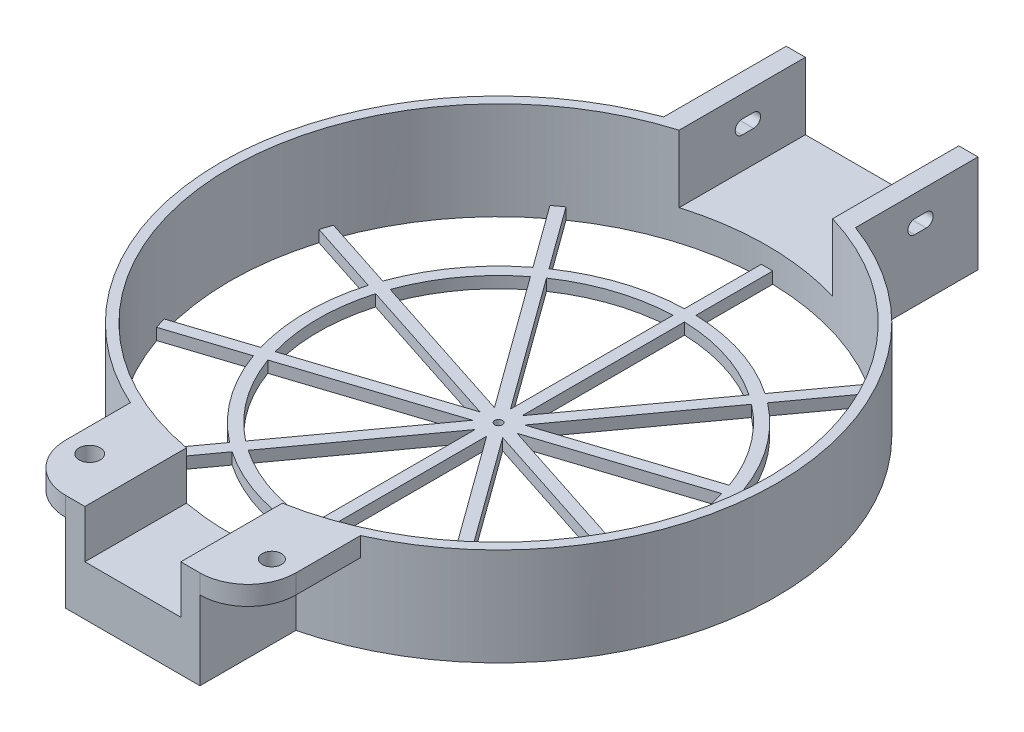
from build123d import *

# Parameters (mm, degrees)
SKETCH1_R               = 72.5
SKETCH1_R_2             = 70
BOSS_EXTRUDE4_DEPTH     = 16
BOSS_EXTRUDE5_DEPTH     = 50
SKETCH2_R               = 1
CUT_EXTRUDE1_DEPTH      = 115.072345465
SKETCH3_R               = 50
SKETCH3_R_2             = 47
BOSS_EXTRUDE6_DEPTH     = 50
SKETCH1_12_R            = 72.5
SKETCH1_12_R_2          = 70
BOSS_EXTRUDE7_DEPTH     = 72.5
BOSS_EXTRUDE8_DEPTH     = 26
SKETCH5_W               = 25
SKETCH5_H               = 25
CUT_EXTRUDE4_DEPTH      = 137.5
SKETCH7_R               = 2.75
SKETCH7_R_2             = 2.5
BOSS_EXTRUDE9_DEPTH     = 5
SKETCH12_W              = 40
SKETCH12_H              = 45
CUT_EXTRUDE5_DEPTH      = 180
BOSS_EXTRUDE11_START    = -49.596857296
BOSS_EXTRUDE11_DEPTH    = 49.596857296
SKETCH12_2_W            = 40
SKETCH12_2_H            = 45
CUT_EXTRUDE6_DEPTH      = 199.5
CUT_EXTRUDE7_DEPTH      = 136.410776564
CUT_EXTRUDE7_DEPTH_BACK = 136.410776564
SKETCH17_W              = 54.58952291
SKETCH17_H              = 5.845779458
CUT_EXTRUDE8_DEPTH      = 158.362345779
CUT_EXTRUDE8_DEPTH_BACK = 158.362345779
SKETCH22_W              = 10
SKETCH22_H              = 10
BOSS_EXTRUDE12_DEPTH    = 22.903142704
CUT_EXTRUDE9_DEPTH      = 144.988394911
CUT_EXTRUDE9_DEPTH_BACK = 144.988394911
SKETCH24_W              = 215.86755616
SKETCH24_H              = 61.868005926
BOSS_EXTRUDE13_DEPTH    = 5
SKETCH27_W              = 40.372489194
SKETCH27_H              = 5.878977483
CUT_EXTRUDE11_DEPTH     = 5


with BuildPart() as part:
    # Sketch1 → Boss-Extrude4 (new body)
    with BuildSketch(Plane(origin=(0, 0, 0), x_dir=(1, 0, 0), z_dir=(0, 1, 0))):
        with Locations(Location((0, 0, 0), (0, 0, 270))):
            Circle(SKETCH1_R)
        with Locations(Location((0, 0, 0), (0, 0, 270))):
            Circle(SKETCH1_R_2, mode=Mode.SUBTRACT)
    extrude(amount=BOSS_EXTRUDE4_DEPTH)

    # Sketch1<11> → Boss-Extrude5 (add)
    with BuildSketch(Plane(origin=(0, 0, 0), x_dir=(1, 0, 0), z_dir=(0, 1, 0))):
        Polygon((1.5, 69.983926726), (0, 70.992443901), (-1.5, 69.983926726), (-1.5, 4.616525306), (-39.921994536, 57.499863933), (-41.728311549, 57.434093588), (-42.349045519, 55.736508176), (-3.927050983, 2.853169549), (-66.095144057, 23.052807466), (-67.51782638, 21.937871638), (-67.02219504, 20.199637917), (-4.854101966, 0), (-67.02219504, -20.199637917), (-67.51782638, -21.937871638), (-66.095144057, -23.052807466), (-3.927050983, -2.853169549), (-42.349045519, -55.736508176), (-41.728311549, -57.434093588), (-39.921994536, -57.499863933), (-1.5, -4.616525306), (-1.5, -69.983926726), (0, -70.992443901), (1.5, -69.983926726), (1.5, -4.616525306), (39.921994536, -57.499863933), (41.728311549, -57.434093588), (42.349045519, -55.736508176), (3.927050983, -2.853169549), (66.095144057, -23.052807466), (67.51782638, -21.937871638), (67.02219504, -20.199637917), (4.854101966, 0), (67.02219504, 20.199637917), (67.51782638, 21.937871638), (66.095144057, 23.052807466), (3.927050983, 2.853169549), (42.349045519, 55.736508176), (41.728311549, 57.434093588), (39.921994536, 57.499863933), (1.5, 4.616525306), align=None)
    extrude(amount=BOSS_EXTRUDE5_DEPTH)

    # Sketch2 → Cut-Extrude1 (cut, through all)
    with BuildSketch(Plane.XZ):
        with Locations(Location((0, 0, 0), (0, 0, 270))):
            Circle(SKETCH2_R)
    extrude(amount=-CUT_EXTRUDE1_DEPTH, mode=Mode.SUBTRACT)

    # Sketch3 → Boss-Extrude6 (add)
    with BuildSketch(Plane.XZ):
        Circle(SKETCH3_R)
        Circle(SKETCH3_R_2, mode=Mode.SUBTRACT)
    extrude(amount=-BOSS_EXTRUDE6_DEPTH)

    # Sketch1<12> → Boss-Extrude7 (add)
    with BuildSketch(Plane(origin=(0, 0, 0), x_dir=(1, 0, 0), z_dir=(0, 1, 0))):
        with Locations(Location((0, 0, 0), (0, 0, 270))):
            Circle(SKETCH1_12_R)
        with Locations(Location((0, 0, 0), (0, 0, 91.227860685))):
            Circle(SKETCH1_12_R_2, mode=Mode.SUBTRACT)
    extrude(amount=BOSS_EXTRUDE7_DEPTH)

    # Sketch6 → Boss-Extrude8 (add)
    with BuildSketch(Plane(origin=(0, 72.5, 0), x_dir=(1, 0, 0), z_dir=(0, 1, 0))):
        Polygon((-12.5, -95.356236397), (12.5, -95.356236397), (17.5, -95.356236397), (17.5, -70.356236397), (12.5, -70.356236397), (-12.5, -70.356236397), (-17.5, -70.356236397), (-17.5, -95.356236397), align=None)
    extrude(amount=-BOSS_EXTRUDE8_DEPTH)

    # Sketch5 → Cut-Extrude4 (cut)
    with BuildSketch(Plane.XY):
        with Locations((0, 72.5)):
            Rectangle(SKETCH5_W, SKETCH5_H)
    extrude(amount=CUT_EXTRUDE4_DEPTH, mode=Mode.SUBTRACT)

    # Sketch7 → Boss-Extrude9 (add)
    # profile 1 of 2: a face of its own
    with BuildSketch(Plane(origin=(0, 72.5, 0), x_dir=(1, 0, 0), z_dir=(0, 1, 0))):
        with BuildLine():
            Line((-30, -82.856236397), (-30, -66.001893912))
            Line((-30, -66.001893912), (-17.5, -70.356236397))
            Line((-17.5, -70.356236397), (-17.5, -95.356236397))
            ThreePointArc((-17.5, -95.356236397), (-26.338834765, -91.695071162), (-30, -82.856236397))
        make_face()
        with Locations(Location((-23.75, -82.856236397, 0), (0, 0, 270))):
            Circle(SKETCH7_R, mode=Mode.SUBTRACT)
    # profile 2 of 2: a face of its own
    with BuildSketch(Plane(origin=(0, 72.5, 0), x_dir=(1, 0, 0), z_dir=(0, 1, 0))):
        with BuildLine():
            Line((30, -82.856236397), (30, -66.001893912))
            Line((30, -66.001893912), (17.5, -70.356236397))
            Line((17.5, -70.356236397), (17.5, -95.356236397))
            ThreePointArc((17.5, -95.356236397), (26.338834765, -91.695071162), (30, -82.856236397))
        make_face()
        with Locations(Location((23.75, -82.856236397, 0), (0, 0, 270))):
            Circle(SKETCH7_R_2, mode=Mode.SUBTRACT)
    extrude(amount=-BOSS_EXTRUDE9_DEPTH)

    # Sketch12 → Cut-Extrude5 (cut)
    with BuildSketch(Plane.XY):
        with Locations((0, 72.5)):
            Rectangle(SKETCH12_W, SKETCH12_H)
    extrude(amount=-CUT_EXTRUDE5_DEPTH, mode=Mode.SUBTRACT)

    # Sketch15 → Boss-Extrude11 (add)
    with BuildSketch(Plane(origin=(0, 72.5, 0), x_dir=(1, 0, 0), z_dir=(0, 1, 0)).offset(BOSS_EXTRUDE11_START)):
        with BuildLine():
            Line((-25, 103.053287944), (25, 103.053287944))
            Line((25, 103.053287944), (25, 68.053287944))
            ThreePointArc((25, 68.053287944), (0, 72.5), (-25, 68.053287944))
            Line((-25, 68.053287944), (-25, 103.053287944))
        make_face()
    extrude(amount=BOSS_EXTRUDE11_DEPTH)

    # Sketch12<2> → Cut-Extrude6 (cut)
    with BuildSketch(Plane.XY):
        with Locations((0, 72.5)):
            Rectangle(SKETCH12_2_W, SKETCH12_2_H)
    extrude(amount=-CUT_EXTRUDE6_DEPTH, mode=Mode.SUBTRACT)

    # Sketch17 → Cut-Extrude7 (cut, two sides: drawn at the far end of the back side and taken through both)
    with BuildSketch(Plane.XZ.offset(-22.903142704).offset(-CUT_EXTRUDE7_DEPTH_BACK)):
        with Locations((-0.620011984, -102.924929054)):
            Rectangle(SKETCH17_W, SKETCH17_H)
    extrude(amount=CUT_EXTRUDE7_DEPTH + CUT_EXTRUDE7_DEPTH_BACK, mode=Mode.SUBTRACT)

    # Sketch20 → Cut-Extrude8 (cut, two sides: drawn at the far end of the back side and taken through both)
    with BuildSketch(Plane(origin=(25, 0, 0), x_dir=(0, 0, -1), z_dir=(1, 0, 0)).offset(-CUT_EXTRUDE8_DEPTH_BACK)):
        with BuildLine():
            Line((83.502039325, 66.8), (86.502039325, 66.8))
            ThreePointArc((86.502039325, 66.8), (88.302039325, 65), (86.502039325, 63.2))
            Line((86.502039325, 63.2), (83.502039325, 63.2))
            ThreePointArc((83.502039325, 63.2), (81.702039325, 65), (83.502039325, 66.8))
        make_face()
    extrude(amount=CUT_EXTRUDE8_DEPTH + CUT_EXTRUDE8_DEPTH_BACK, mode=Mode.SUBTRACT)

    # Sketch22 → Boss-Extrude12 (add)
    with BuildSketch(Plane.XZ.offset(-22.903142704)):
        with Locations((0, -77.327380707)):
            Rectangle(SKETCH22_W, SKETCH22_H)
    extrude(amount=BOSS_EXTRUDE12_DEPTH)

    # Sketch24 → Cut-Extrude9 (cut, two sides: drawn at the far end of the back side and taken through both)
    with BuildSketch(Plane(origin=(1.5, 0, 0), x_dir=(0, 0, -1), z_dir=(1, 0, 0)).offset(-CUT_EXTRUDE9_DEPTH_BACK)):
        with Locations((14.738289666, 16.065997037)):
            Rectangle(SKETCH24_W, SKETCH24_H)
    extrude(amount=CUT_EXTRUDE9_DEPTH + CUT_EXTRUDE9_DEPTH_BACK, mode=Mode.SUBTRACT)

    # Sketch25 → Boss-Extrude13 (add)
    with BuildSketch(Plane(origin=(0, 50, 0), x_dir=(1, 0, 0), z_dir=(0, 1, 0))):
        with BuildLine():
            Line((-20, 67.082039325), (-20, 100.002039325))
            Line((-20, 100.002039325), (20, 100.002039325))
            Line((20, 100.002039325), (20, 67.082039325))
            ThreePointArc((20, 67.082039325), (0, 70), (-20, 67.082039325))
        make_face()
    extrude(amount=BOSS_EXTRUDE13_DEPTH)

    # Sketch27 → Cut-Extrude11 (cut)
    with BuildSketch(Plane(origin=(0, 0, 93.195488414), x_dir=(-1, 0, 0), z_dir=(0, 0, -1))):
        with Locations((1.632930754, 44.060511259)):
            Rectangle(SKETCH27_W, SKETCH27_H)
    extrude(amount=-CUT_EXTRUDE11_DEPTH, mode=Mode.SUBTRACT)


solid = part.part
